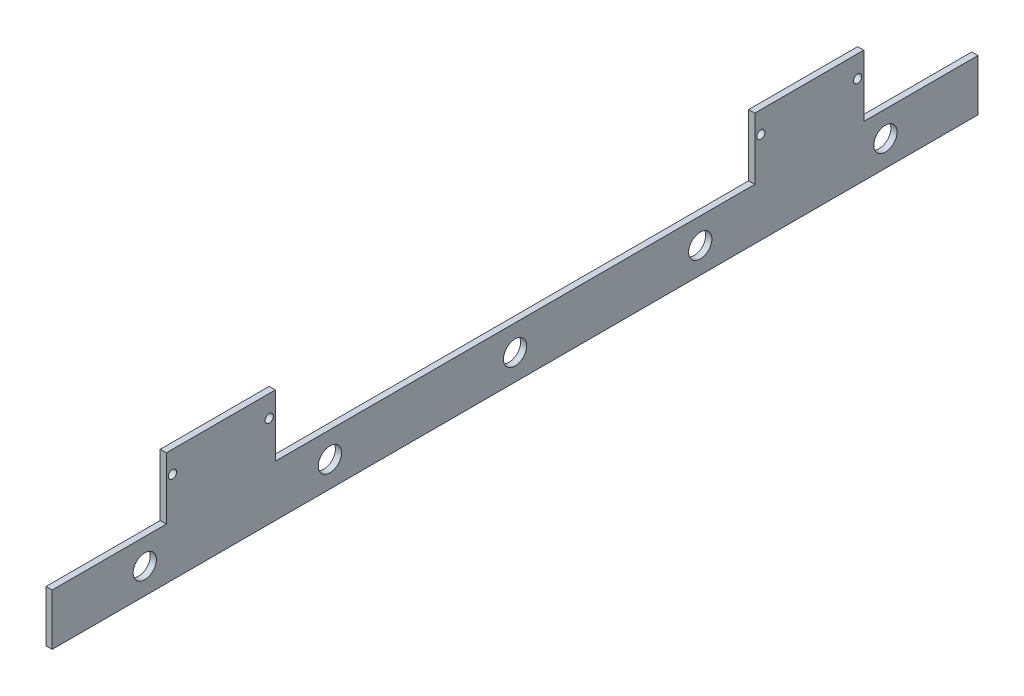
from build123d import *

# Parameters (mm, degrees)
SKETCH_1_W          = 450
SKETCH_1_H          = 25
EXTRUDE_1_DEPTH     = 3
SKETCH_2_W          = 53
SKETCH_2_H          = 30
SKETCH_2_R          = 2
EXTRUDE_2_DEPTH     = 3
SKETCH_3_R          = 5.655027455
CUT_EXTRUDE_1_DEPTH = 454.358577728


with BuildPart() as part:
    # 草图1 → 凸台-拉伸1 (new body)
    with BuildSketch(Plane(origin=(0, 0, 0), x_dir=(0, 0, -1), z_dir=(1, 0, 0))):
        with Locations((225, 12.5)):
            Rectangle(SKETCH_1_W, SKETCH_1_H)
    extrude(amount=EXTRUDE_1_DEPTH)

    # 草图2 → 凸台-拉伸2 (add)
    # profile 1 of 2: a face of its own
    with BuildSketch(Plane(origin=(3, 0, 0), x_dir=(0, 0, -1), z_dir=(1, 0, 0))):
        with Locations((82, 40)):
            Rectangle(SKETCH_2_W, SKETCH_2_H)
        with Locations((58.5, 44.5)):
            Circle(SKETCH_2_R, mode=Mode.SUBTRACT)
        with Locations(Location((105.5, 44.5, 0), (0, 0, 180))):
            Circle(SKETCH_2_R, mode=Mode.SUBTRACT)
    # profile 2 of 2: a face of its own
    with BuildSketch(Plane(origin=(3, 0, 0), x_dir=(0, 0, -1), z_dir=(1, 0, 0))):
        with Locations((368, 40)):
            Rectangle(SKETCH_2_W, SKETCH_2_H)
        with Locations((344.5, 44.5)):
            Circle(SKETCH_2_R, mode=Mode.SUBTRACT)
        with Locations(Location((391.5, 44.5, 0), (0, 0, 180))):
            Circle(SKETCH_2_R, mode=Mode.SUBTRACT)
    extrude(amount=-EXTRUDE_2_DEPTH)

    # 草图3 → 切除-拉伸1 (cut, through all)
    with BuildSketch(Plane(origin=(3, 0, 0), x_dir=(0, 0, -1), z_dir=(1, 0, 0))):
        with Locations((225, 12.5)):
            Circle(SKETCH_3_R)
        with Locations((315, 12.5)):
            Circle(SKETCH_3_R)
        with Locations((405, 12.5)):
            Circle(SKETCH_3_R)
        with Locations((135, 12.5)):
            Circle(SKETCH_3_R)
        with Locations((45, 12.5)):
            Circle(SKETCH_3_R)
    extrude(amount=-CUT_EXTRUDE_1_DEPTH, mode=Mode.SUBTRACT)


solid = part.part
